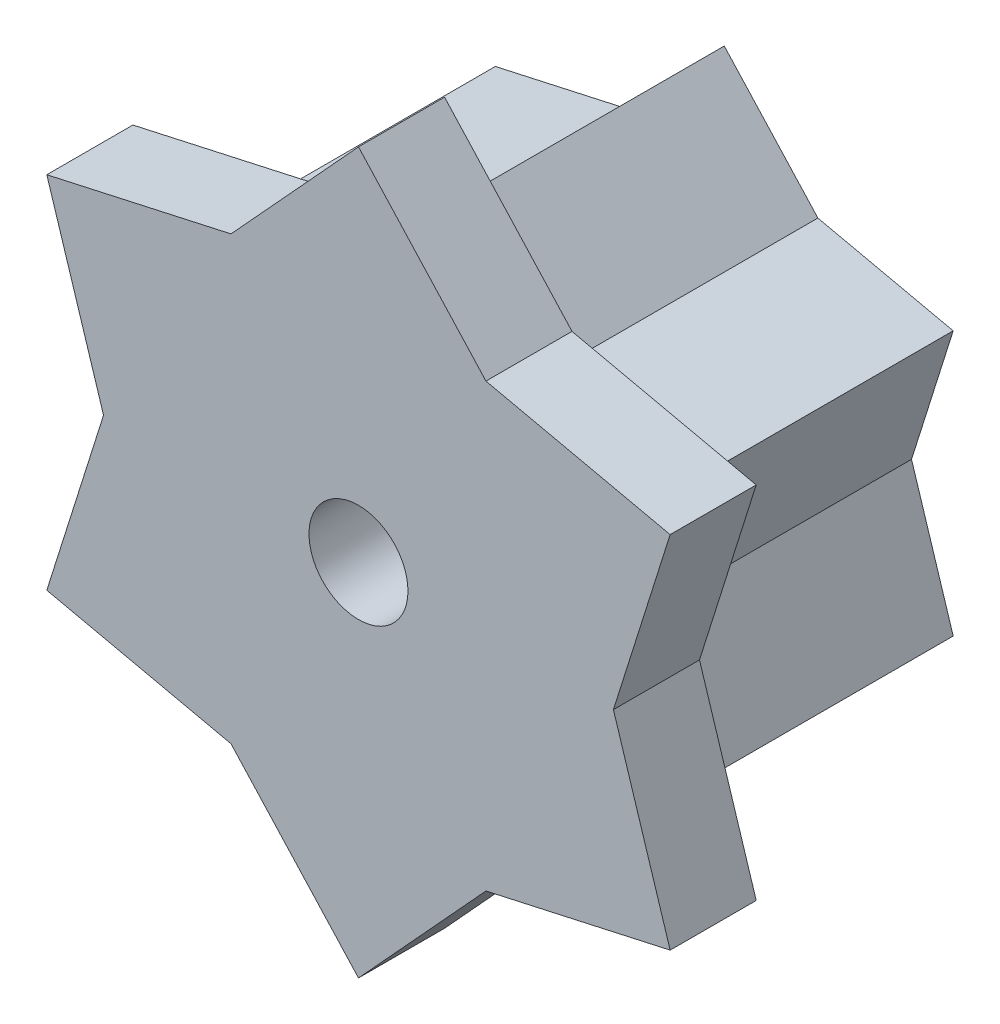
from build123d import *

# Parameters (mm, degrees)
BOSS_EXTRUDE1_DEPTH     = 6.5
BOSS_EXTRUDE2_DEPTH     = 2
CUT_EXTRUDE1_DEPTH      = 13.83145703
CUT_EXTRUDE1_DEPTH_BACK = 13.83145703
SKETCH1_4_R             = 1.15
CHAMFER1_SIZE           = 0.4


with BuildPart() as part:
    # Sketch1 → Boss-Extrude1 (new body)
    with BuildSketch(Plane.XY):
        Polygon((2.175697935, 3.768419365), (0, 6.142777017), (-2.175697935, 3.768419365), (-5.319800946, 3.071388508), (-4.351395869, 0), (-5.319800946, -3.071388508), (-2.175697935, -3.768419365), (0, -6.142777017), (2.175697935, -3.768419365), (5.319800946, -3.071388508), (4.351395869, 0), (5.319800946, 3.071388508), align=None)
    extrude(amount=-BOSS_EXTRUDE1_DEPTH)

    # Sketch2 → Boss-Extrude2 (add)
    with BuildSketch(Plane.XY):
        Polygon((7.242620565, 4.181528933), (2.962094779, 5.130498653), (0, 8.363057866), (-2.962094779, 5.130498653), (-7.242620565, 4.181528933), (-5.924189557, 0), (-7.242620565, -4.181528933), (-2.962094779, -5.130498653), (0, -8.363057866), (2.962094779, -5.130498653), (7.242620565, -4.181528933), (5.924189557, 0), align=None)
    extrude(amount=BOSS_EXTRUDE2_DEPTH)

    # Sketch1<4> → Cut-Extrude1 (cut, two sides: drawn at the far end of the back side and taken through both)
    with BuildSketch(Plane.XY.offset(-CUT_EXTRUDE1_DEPTH_BACK)):
        Circle(SKETCH1_4_R)
    extrude(amount=CUT_EXTRUDE1_DEPTH + CUT_EXTRUDE1_DEPTH_BACK, mode=Mode.SUBTRACT)

    # Chamfer1
    chamfer1_edges = [part.edges().sort_by_distance(p)[0] for p in [
        (3.74774944, -3.419903937, 0),
        (1.087848967, -4.955598191, 0),
        (-1.087848967, -4.955598191, 0),
        (-3.74774944, -3.419903937, 0),
        (-4.835598408, -1.535694254, 0),
        (-4.835598408, 1.535694254, 0),
        (-3.74774944, 3.419903937, 0),
        (4.835598408, -1.535694254, 0),
        (4.835598408, 1.535694254, 0),
        (3.74774944, 3.419903937, 0),
        (1.087848967, 4.955598191, 0),
        (-1.087848967, 4.955598191, 0),
    ]]
    chamfer(chamfer1_edges, length=CHAMFER1_SIZE)


solid = part.part
